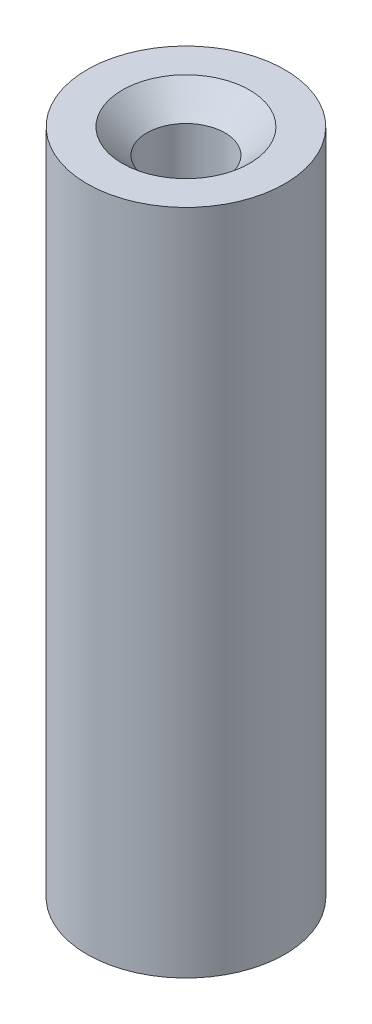
from build123d import *

# Parameters (mm, degrees)
SKIZZE1_R                       = 4
SKIZZE1_R_2                     = 1.575
AUFSATZ_LINEAR_AUSTRAGEN1_DEPTH = 27
FASE1_SIZE                      = 1


with BuildPart() as part:
    # Skizze1 → Aufsatz-Linear austragen1 (new body)
    with BuildSketch(Plane(origin=(0, 0, 0), x_dir=(1, 0, 0), z_dir=(0, 1, 0))):
        with Locations(Location((0, 0, 0), (0, 0, 270))):
            Circle(SKIZZE1_R)
        with Locations(Location((0, 0, 0), (0, 0, 270))):
            Circle(SKIZZE1_R_2, mode=Mode.SUBTRACT)
    extrude(amount=AUFSATZ_LINEAR_AUSTRAGEN1_DEPTH)

    # Fase1
    fase1_edges = [part.edges().sort_by_distance(p)[0] for p in [
        (0, 0, -1.575),
        (0, 27, -1.575),
    ]]
    chamfer(fase1_edges, length=FASE1_SIZE)


solid = part.part
